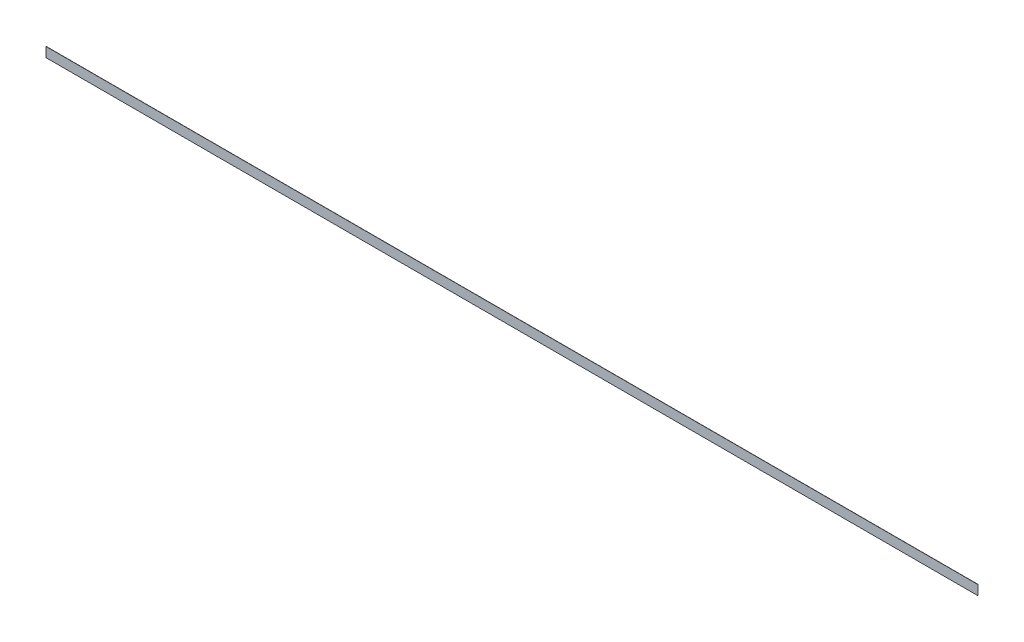
from build123d import *

# Parameters (mm, degrees)
SKETCH1_W           = 480
SKETCH1_H           = 5
BOSS_EXTRUDE1_DEPTH = 0.1


with BuildPart() as part:
    # Sketch1 → Boss-Extrude1 (new body)
    with BuildSketch(Plane.XY):
        with Locations((240, -2.5)):
            Rectangle(SKETCH1_W, SKETCH1_H)
    extrude(amount=BOSS_EXTRUDE1_DEPTH)


solid = part.part
